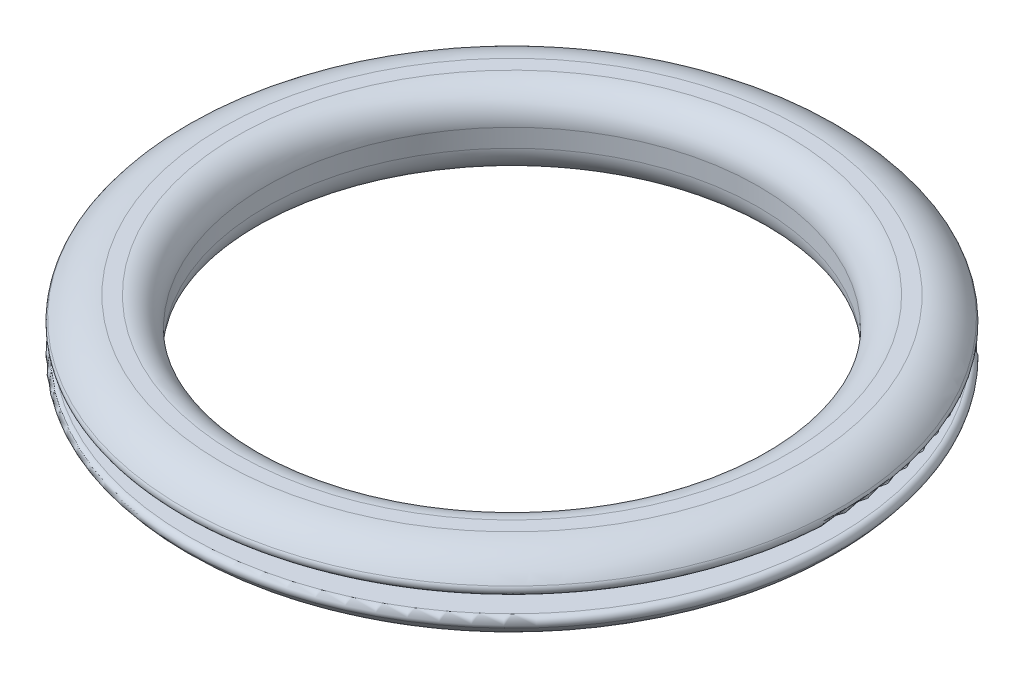
from build123d import *

# Parameters (mm, degrees)
FILLET1_R = 2.54
FILLET2_R = 0.508


with BuildPart() as part:
    # Sketch1 → Revolve1 (revolve)
    with BuildSketch(Plane.XY, mode=Mode.PRIVATE) as revolve1_sk:
        with BuildLine():
            Line((21.59, 3.33375), (21.59, -3.33375))
            Line((21.59, -3.33375), (25.4, -3.33375))
            ThreePointArc((25.4, -3.33375), (27.68952506, -2.64053759), (29.21, -0.79375))
            Line((29.21, -0.79375), (25.4, -0.79375))
            Line((25.4, -0.79375), (25.4, 0.79375))
            Line((25.4, 0.79375), (29.21, 0.79375))
            ThreePointArc((29.21, 0.79375), (27.68952506, 2.64053759), (25.4, 3.33375))
            Line((25.4, 3.33375), (21.59, 3.33375))
        make_face()
    revolve(revolve1_sk.sketch.rotate(Axis((0, 0, 0), (0, 1, 0)), 90), axis=Axis((0, 0, 0), (0, 1, 0)))

    # Fillet1
    fillet1_edges = [part.edges().sort_by_distance(p)[0] for p in [
        (0, -3.33375, 21.59),
        (0, 3.33375, 21.59),
    ]]
    fillet(fillet1_edges, radius=FILLET1_R)

    # Fillet2
    fillet2_edges = [part.edges().sort_by_distance(p)[0] for p in [
        (0, 0.79375, 29.21),
        (0, -0.79375, 29.21),
    ]]
    fillet(fillet2_edges, radius=FILLET2_R)


solid = part.part
